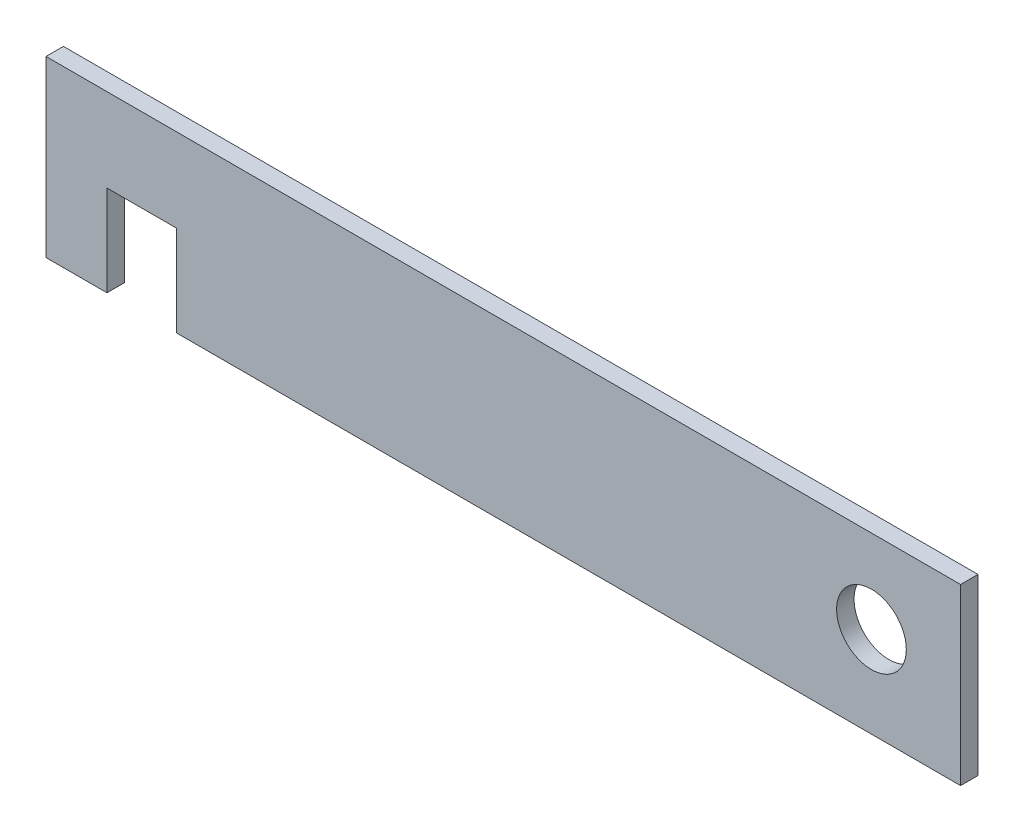
from build123d import *

# Parameters (mm, degrees)
SKETCH1_R           = 20
BOSS_EXTRUDE1_DEPTH = 10


with BuildPart() as part:
    # Sketch1 → Boss-Extrude1 (new body)
    with BuildSketch(Plane.XY):
        Polygon((-227.5, 0), (-227.5, 52.087426326), (-187.5, 52.087426326), (-187.5, 0), (262.5, 0), (262.5, 100), (-262.5, 100), (-262.5, 0), align=None)
        with Locations((211.338732731, 52.087426326)):
            Circle(SKETCH1_R, mode=Mode.SUBTRACT)
    extrude(amount=BOSS_EXTRUDE1_DEPTH)


solid = part.part
